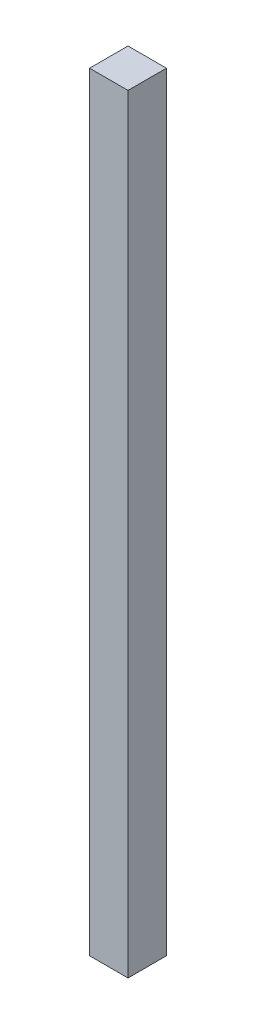
from build123d import *

# Parameters (mm, degrees)
EXTRUDE_1_DEPTH      = 200
EXTRUDE_1_DEPTH_BACK = 200
SKETCH_1_W           = 20
SKETCH_1_H           = 20


with BuildPart() as part:
    # 草图1 → 凸台-拉伸1 (new, two sides: drawn at the far end of the back side and taken through both)
    with BuildSketch(Plane(origin=(0, 0, 0), x_dir=(1, 0, 0), z_dir=(0, 1, 0)).offset(-EXTRUDE_1_DEPTH_BACK)):
        Rectangle(SKETCH_1_W, SKETCH_1_H)
    extrude(amount=EXTRUDE_1_DEPTH + EXTRUDE_1_DEPTH_BACK)


solid = part.part
